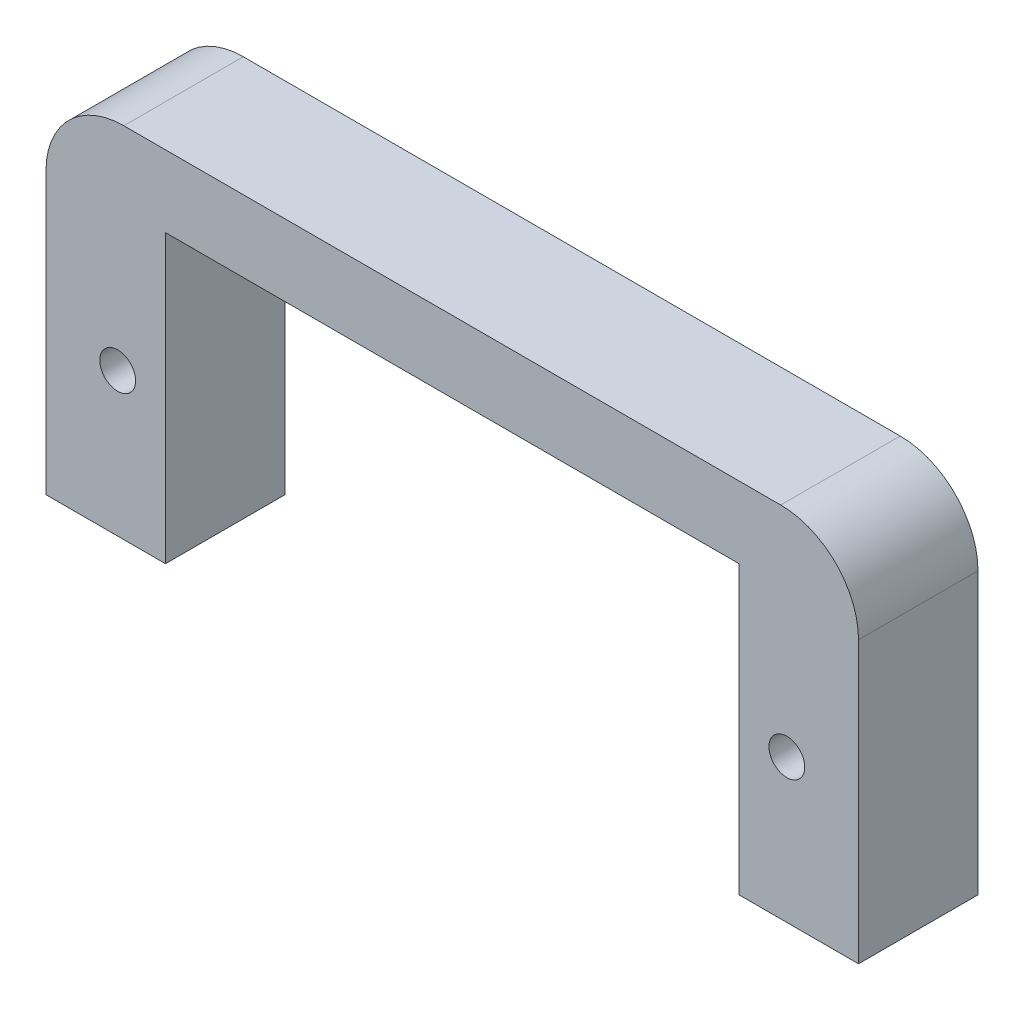
from build123d import *

# Parameters (mm, degrees)
CROQUIS1_R              = 0.75
SALIENTE_EXTRUIR1_DEPTH = 2.5


with BuildPart() as part:
    # Croquis1 → Saliente-Extruir1 (new, symmetric)
    with BuildSketch(Plane.XY):
        with BuildLine():
            Line((-12, 6), (12, 6))
            Line((12, 6), (12, -6))
            Line((12, -6), (17, -6))
            Line((17, -6), (17, 5.74451768))
            ThreePointArc((17, 5.74451768), (16.046491304, 8.046491304), (13.74451768, 9))
            Line((13.74451768, 9), (-13.74451768, 9))
            ThreePointArc((-13.74451768, 9), (-16.046491304, 8.046491304), (-17, 5.74451768))
            Line((-17, 5.74451768), (-17, -6))
            Line((-17, -6), (-12, -6))
            Line((-12, -6), (-12, 6))
        make_face()
        with Locations((-14, 0)):
            Circle(CROQUIS1_R, mode=Mode.SUBTRACT)
        with Locations(Location((14, 0, 0), (0, 0, 180))):
            Circle(CROQUIS1_R, mode=Mode.SUBTRACT)
    extrude(amount=SALIENTE_EXTRUIR1_DEPTH, both=True)


solid = part.part
